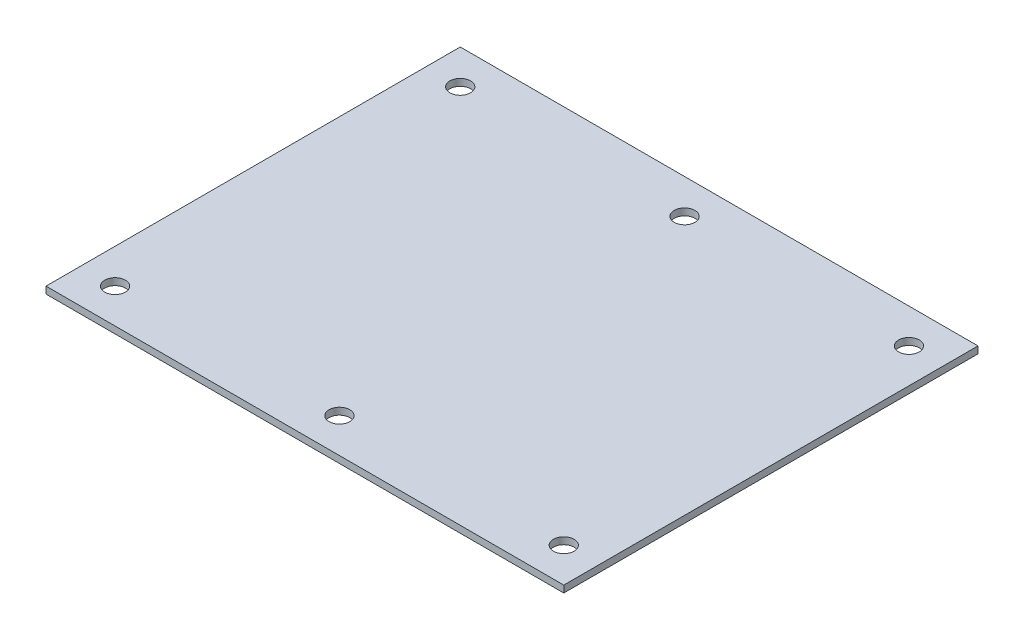
from build123d import *

# Parameters (mm, degrees)
SKETCH_1_W          = 75
SKETCH_1_H          = 60
EXTRUDE_1_DEPTH     = 1
SKETCH_2_R          = 1.5
CUT_EXTRUDE_1_DEPTH = 49.033842236


with BuildPart() as part:
    # 草图1 → 凸台-拉伸1 (new body)
    with BuildSketch(Plane(origin=(0, 0, 0), x_dir=(1, 0, 0), z_dir=(0, 1, 0))):
        Rectangle(SKETCH_1_W, SKETCH_1_H)
    extrude(amount=EXTRUDE_1_DEPTH)

    # 草图2 → 切除-拉伸1 (cut, through all)
    with BuildSketch(Plane(origin=(0, 0, 0), x_dir=(1, 0, 0), z_dir=(0, 1, 0))):
        with Locations(Location((-32.5, 25, 0), (0, 0, 270))):
            Circle(SKETCH_2_R)
        with Locations(Location((-32.5, -25, 0), (0, 0, 90))):
            Circle(SKETCH_2_R)
        with Locations(Location((32.5, -25, 0), (0, 0, 270))):
            Circle(SKETCH_2_R)
        with Locations(Location((32.5, 25, 0), (0, 0, 90))):
            Circle(SKETCH_2_R)
        with Locations(Location((0, -25, 0), (0, 0, 90))):
            Circle(SKETCH_2_R)
        with Locations(Location((0, 25, 0), (0, 0, 90))):
            Circle(SKETCH_2_R)
    extrude(amount=CUT_EXTRUDE_1_DEPTH, mode=Mode.SUBTRACT)


solid = part.part
